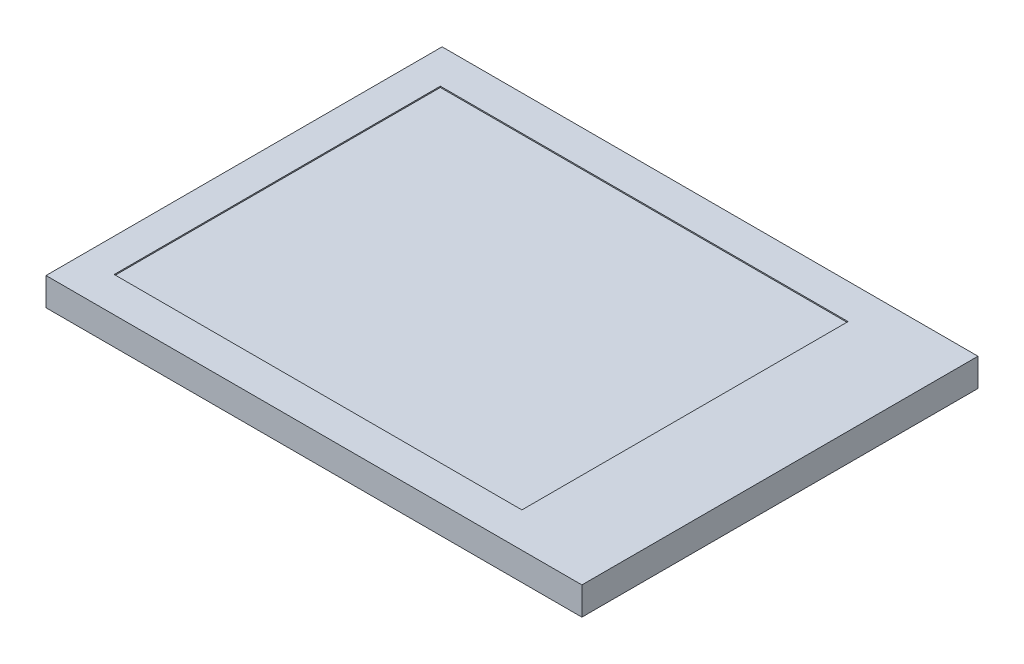
from build123d import *

# Parameters (mm, degrees)
SKETCH_1_W          = 46
SKETCH_1_H          = 34
EXTRUDE_1_DEPTH     = 2.4
SKETCH_2_W          = 35
SKETCH_2_H          = 28
CUT_EXTRUDE_1_DEPTH = 0.1


with BuildPart() as part:
    # 草图1 → 凸台-拉伸1 (new body)
    with BuildSketch(Plane(origin=(0, 0, 0), x_dir=(1, 0, 0), z_dir=(0, 1, 0))):
        with Locations((23, 17)):
            Rectangle(SKETCH_1_W, SKETCH_1_H)
    extrude(amount=EXTRUDE_1_DEPTH)

    # 草图2 → 切除-拉伸1 (cut)
    with BuildSketch(Plane(origin=(0, 2.4, 0), x_dir=(1, 0, 0), z_dir=(0, 1, 0))):
        with Locations((20.35, 17)):
            Rectangle(SKETCH_2_W, SKETCH_2_H)
    extrude(amount=-CUT_EXTRUDE_1_DEPTH, mode=Mode.SUBTRACT)


solid = part.part
